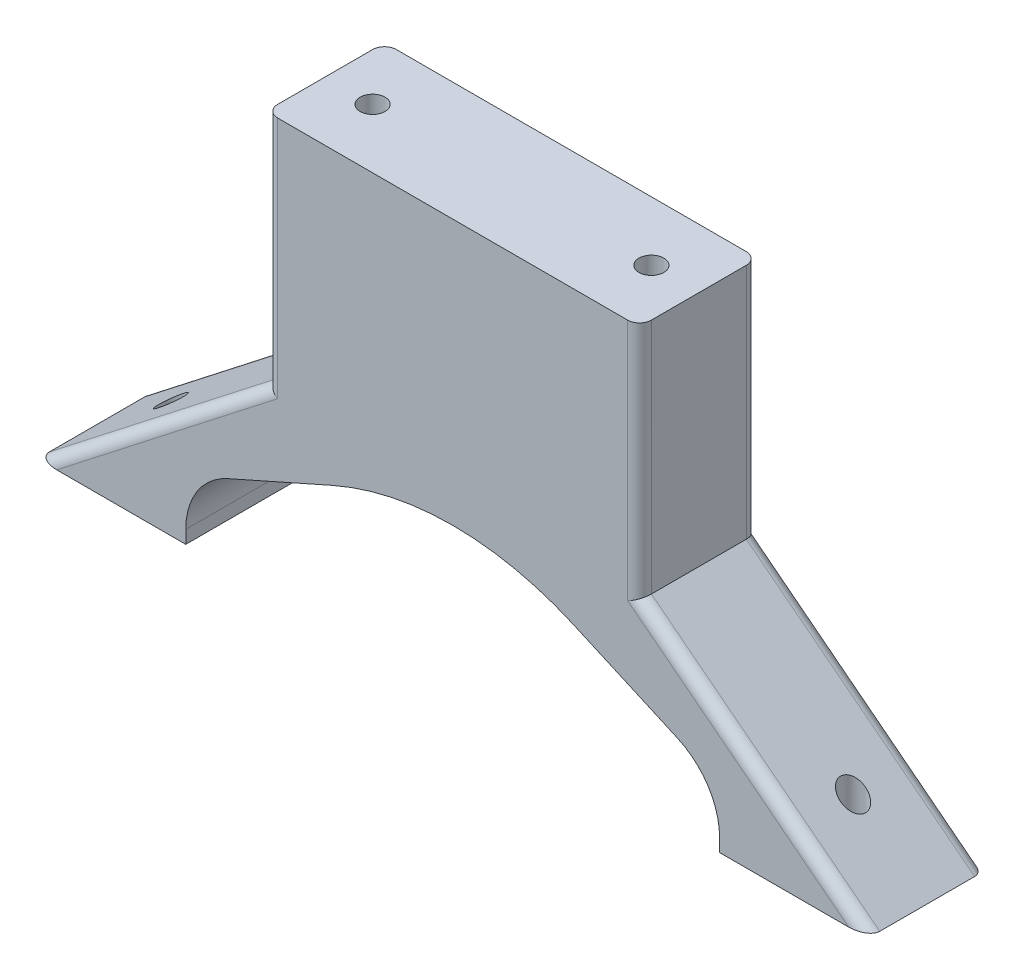
from build123d import *

# Parameters (mm, degrees)
SKETCH8_W                   = 63
SKETCH8_H                   = 40
BOSS_EXTRUDE3_DEPTH         = 20
TAP_DRILL_FOR_M5X0_8_TAP2_D = 4.2
FILLET4_R                   = 2
TAP_DRILL_FOR_M5X0_8_TAP3_D = 4.2
FILLET6_R                   = 12


with BuildPart() as part:
    # Sketch8 → Boss-Extrude3 (new body)
    with BuildSketch(Plane.XY):
        with BuildLine():
            Line((63, -43.532093881), (0, -43.532093881))
            Line((0, -43.532093881), (-25.666666667, -63.532093881))
            Line((-25.666666667, -63.532093881), (-13.5, -63.532093881))
            Line((-13.5, -63.532093881), (11.242912026, -52.54839108))
            ThreePointArc((11.242912026, -52.54839108), (31.551767994, -48.24798089), (51.856795198, -52.56643302))
            Line((51.856795198, -52.56643302), (76.5, -63.532093881))
            Line((76.5, -63.532093881), (88.666666667, -63.532093881))
            Line((88.666666667, -63.532093881), (63, -43.532093881))
        make_face()
        with Locations((31.5, -23.532093881)):
            Rectangle(SKETCH8_W, SKETCH8_H)
        Polygon((-13.5, -63.532093881), (-25.666666667, -63.532093881), (-38.5, -73.532093881), (-13.5, -73.532093881), align=None)
        Polygon((101.5, -73.532093881), (88.666666667, -63.532093881), (76.5, -63.532093881), (76.5, -73.532093881), align=None)
    extrude(amount=-BOSS_EXTRUDE3_DEPTH)

    # Tap Drill for M5x0.8 Tap2 (through all)
    with Locations(Plane(origin=(0, -73.532093881, 0), x_dir=(-1, 0, 0), z_dir=(0, -1, 0))):
        with Locations((26, 10), (-89, 10)):
            Hole(TAP_DRILL_FOR_M5X0_8_TAP2_D / 2)

    # Fillet4
    fillet4_edges = [part.edges().sort_by_distance(p)[0] for p in [
        (63, -23.532093881, 0),
        (82.25, -58.532093881, 0),
        (-19.25, -58.532093881, 0),
        (0, -23.532093881, 0),
        (0, -23.532093881, -20),
        (82.25, -58.532093881, -20),
        (63, -23.532093881, -20),
        (-19.25, -58.532093881, -20),
    ]]
    fillet(fillet4_edges, radius=FILLET4_R)

    # Tap Drill for M5x0.8 Tap3 (through all)
    with Locations(Plane(origin=(0, -3.532093881, 0), x_dir=(1, 0, 0), z_dir=(0, 1, 0))):
        with Locations((8, 10), (55, 10)):
            Hole(TAP_DRILL_FOR_M5X0_8_TAP3_D / 2)

    # Fillet6
    fillet6_edges = [part.edges().sort_by_distance(p)[0] for p in [
        (76.5, -63.532093881, -10),
        (-13.5, -63.532093881, -10),
    ]]
    fillet(fillet6_edges, radius=FILLET6_R)


solid = part.part
